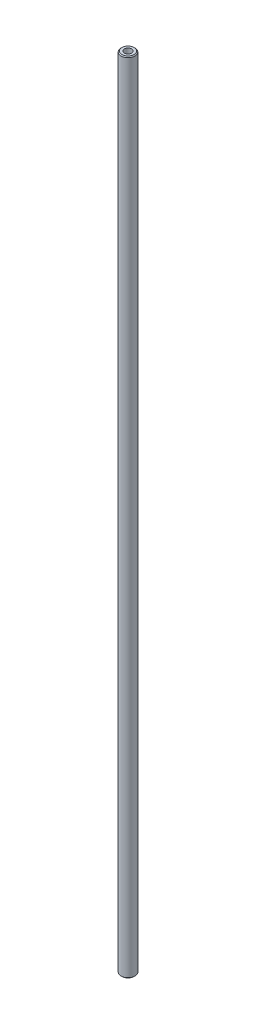
from build123d import *

# Parameters (mm, degrees)
ESBO_O3_R                = 4
RESSALTO_EXTRUS_O1_DEPTH = 229.5
CHANFRO1_SIZE            = 0.5


with BuildPart() as part:
    # Esboço3 → Ressalto-extrusão1 (new, symmetric)
    with BuildSketch(Plane(origin=(0, 0, 0), x_dir=(1, 0, 0), z_dir=(0, 1, 0))):
        with Locations(Location((0, 0, 0), (0, 0, 270))):
            Circle(ESBO_O3_R)
    extrude(amount=RESSALTO_EXTRUS_O1_DEPTH, both=True)

    # Chanfro1
    chanfro1_edges = [part.edges().sort_by_distance(p)[0] for p in [
        (0, -229.5, -4),
        (0, 229.5, -4),
    ]]
    chamfer(chanfro1_edges, length=CHANFRO1_SIZE)

    # Esboço4 → Furo roscado de M51 (revolve, cut)
    with BuildSketch(Plane(origin=(0, 229.5, 0), x_dir=(0, 0, 1), z_dir=(1, 0, 0))):
        Polygon((0, 0), (0, 25.2618073), (2.1, 24), (2.1, 0), align=None)
    furo_roscado_de_m51 = revolve(axis=Axis((0, 235.85, 0), (0, -1, 0)), mode=Mode.SUBTRACT)

    # Espelhar1: Furo roscado de M51 across plane
    add(furo_roscado_de_m51.mirror(Plane.ZX), mode=Mode.SUBTRACT)


solid = part.part
